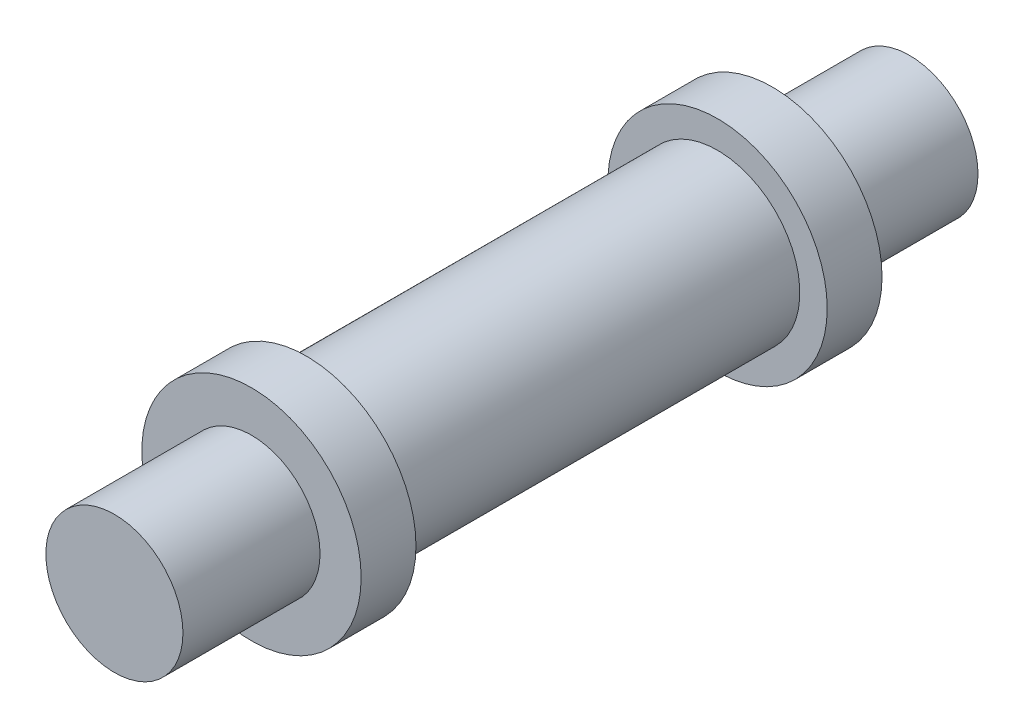
from build123d import *

# Parameters (mm, degrees)
SKETCH1_R           = 3.175
BOSS_EXTRUDE1_DEPTH = 6.35
SKETCH2_R           = 5.08
BOSS_EXTRUDE2_DEPTH = 2.54
SKETCH3_R           = 3.81
BOSS_EXTRUDE3_DEPTH = 19.05
SKETCH4_R           = 5.08
BOSS_EXTRUDE4_DEPTH = 2.54
SKETCH5_R           = 3.175
BOSS_EXTRUDE5_DEPTH = 6.35


with BuildPart() as part:
    # Sketch1 → Boss-Extrude1 (new body)
    with BuildSketch(Plane.XY):
        Circle(SKETCH1_R)
    extrude(amount=BOSS_EXTRUDE1_DEPTH)

    # Sketch2 → Boss-Extrude2 (add)
    with BuildSketch(Plane.XY.offset(6.35)):
        Circle(SKETCH2_R)
    extrude(amount=BOSS_EXTRUDE2_DEPTH)

    # Sketch3 → Boss-Extrude3 (add)
    with BuildSketch(Plane.XY.offset(8.89)):
        with Locations(Location((0, 0, 0), (0, 0, 180))):
            Circle(SKETCH3_R)
    extrude(amount=BOSS_EXTRUDE3_DEPTH)

    # Sketch4 → Boss-Extrude4 (add)
    with BuildSketch(Plane.XY.offset(27.94)):
        Circle(SKETCH4_R)
    extrude(amount=BOSS_EXTRUDE4_DEPTH)

    # Sketch5 → Boss-Extrude5 (add)
    with BuildSketch(Plane.XY.offset(30.48)):
        Circle(SKETCH5_R)
    extrude(amount=BOSS_EXTRUDE5_DEPTH)


solid = part.part
